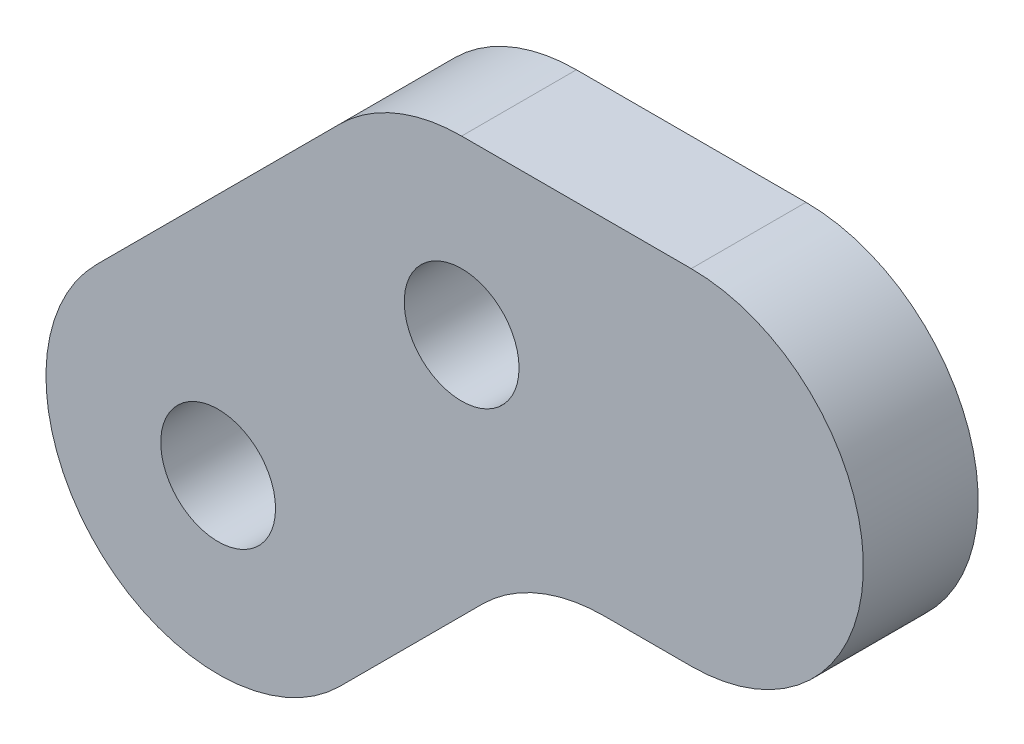
from build123d import *

# Parameters (mm, degrees)
MODEL_R                 = 1.5
SALIENTE_EXTRUIR1_DEPTH = 3


with BuildPart() as part:
    # Model → Saliente-Extruir1 (new body)
    with BuildSketch(Plane.XY):
        with BuildLine():
            Line((139.599121875, 257.495671711), (133.599121875, 257.495671711))
            ThreePointArc((133.599121875, 257.495671711), (131.87704643, 257.153129607), (130.41714136, 256.177652227))
            Line((130.41714136, 256.177652227), (124.053180329, 249.813691196))
            ThreePointArc((124.053180329, 249.813691196), (124.053180329, 243.449730165), (130.41714136, 243.449730165))
            Line((130.41714136, 243.449730165), (134.145063421, 247.177652226))
            ThreePointArc((134.145063421, 247.177652226), (135.604968491, 248.153129607), (137.327043937, 248.495671711))
            Line((137.327043937, 248.495671711), (138.099121875, 248.495671711))
            Line((138.099121875, 248.495671711), (139.599121875, 248.495671711))
            ThreePointArc((139.599121875, 248.495671711), (144.099121875, 252.995671711), (139.599121875, 257.495671711))
        make_face()
        with Locations((133.599121875, 252.995671711)):
            Circle(MODEL_R, mode=Mode.SUBTRACT)
        with Locations((127.235160845, 246.631710681)):
            Circle(MODEL_R, mode=Mode.SUBTRACT)
    extrude(amount=SALIENTE_EXTRUIR1_DEPTH)


solid = part.part
